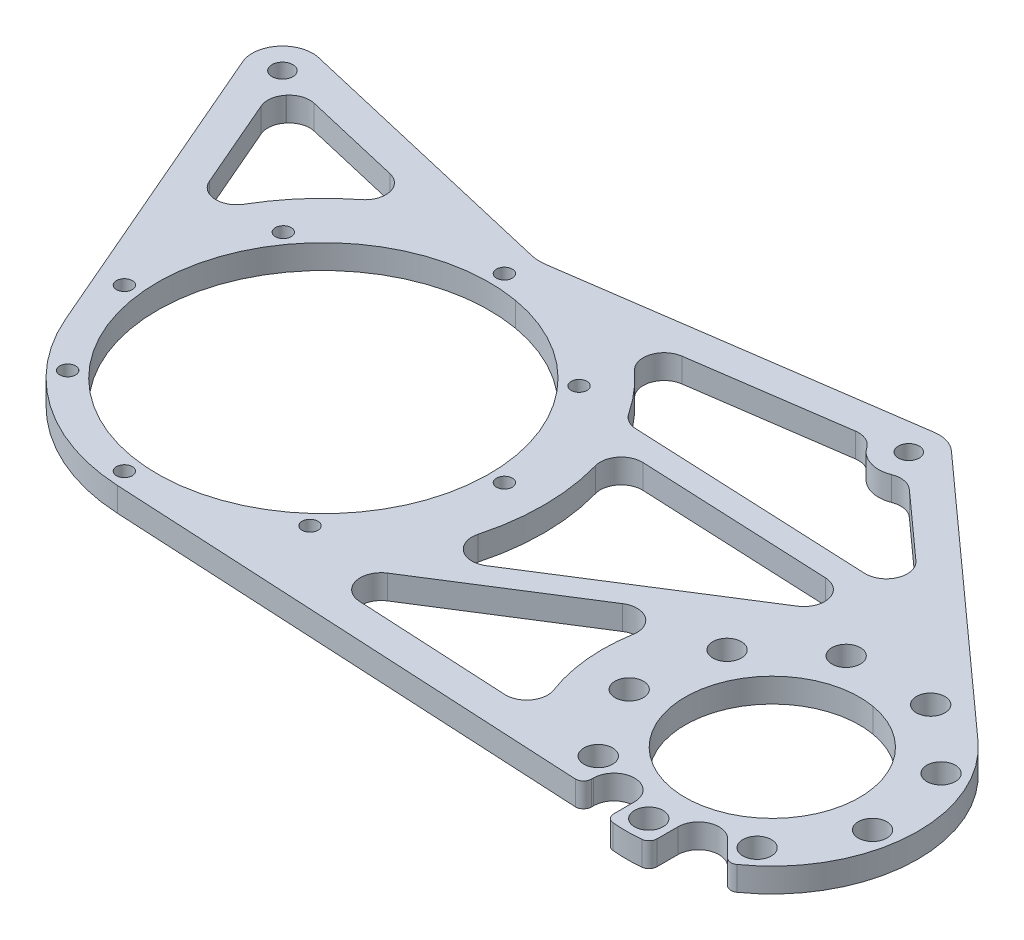
from build123d import *

# Parameters (mm, degrees)
SKETCH2_R           = 4.5
SKETCH2_R_2         = 27.4955
SKETCH2_R_3         = 2.5
SKETCH2_R_4         = 52.3875
SKETCH2_R_5         = 3.3
BOSS_EXTRUDE1_DEPTH = 7.62
CUT_EXTRUDE1_DEPTH  = 977.654400972
FILLET2_R           = 12.7
CUT_EXTRUDE2_DEPTH  = 977.654400972
FILLET3_R           = 6.604


with BuildPart() as part:
    # Sketch2 → Boss-Extrude1 (new body)
    with BuildSketch(Plane(origin=(0, 31.381947118, 0), x_dir=(1, 0, 0), z_dir=(0, 1, 0))):
        with BuildLine():
            ThreePointArc((-706.758334948, -176.701988839), (-700.258334948, -170.201988839), (-693.758334948, -176.701988839))
            Line((-693.758334948, -176.701988839), (-693.758334948, -183.274721629))
            ThreePointArc((-693.758334948, -183.274721629), (-693.101169654, -184.979577479), (-691.469725918, -185.802250576))
            ThreePointArc((-691.469725918, -185.802250576), (-686.919549358, -186.027976628), (-682.369372798, -185.802250576))
            ThreePointArc((-682.369372798, -185.802250576), (-680.737929062, -184.979577479), (-680.080763768, -183.274721629))
            Line((-680.080763768, -183.274721629), (-680.080763768, -176.701988839))
            ThreePointArc((-680.080763768, -176.701988839), (-676.068206079, -170.696771877), (-668.984569691, -172.105794761))
            Line((-668.984569691, -172.105794761), (-663.719686073, -177.370678379))
            ThreePointArc((-663.719686073, -177.370678379), (-662.142049476, -178.105218992), (-660.461885462, -177.651858179))
            ThreePointArc((-660.461885462, -177.651858179), (-641.02731599, -142.794705094), (-656.175138478, -105.872258186))
            Line((-656.175138478, -105.872258186), (-739.714556945, -30.733548866))
            ThreePointArc((-739.714556945, -30.733548866), (-742.67316861, -28.92213442), (-746.084255332, -28.29039661))
            Line((-746.084255332, -28.29039661), (-949.218629158, -22.875315026))
            ThreePointArc((-949.218629158, -22.875315026), (-957.176615495, -27.166188695), (-957.964688125, -36.172857609))
            Line((-957.964688125, -36.172857609), (-915.540423748, -134.526980787))
            ThreePointArc((-915.540423748, -134.526980787), (-894.053054389, -160.825584136), (-861.92593364, -171.83338557))
            Line((-861.92593364, -171.83338557), (-709.298334948, -179.818999281))
            ThreePointArc((-709.298334948, -179.818999281), (-707.502283723, -179.075050505), (-706.758334948, -177.278999281))
            Line((-706.758334948, -177.278999281), (-706.758334948, -176.701988839))
        make_face()
        with Locations((-686.919549358, -179.053976628)):
            Circle(SKETCH2_R, mode=Mode.SUBTRACT)
        with Locations((-711.988266136, -169.92970991)):
            Circle(SKETCH2_R, mode=Mode.SUBTRACT)
        with Locations((-661.85083258, -169.92970991)):
            Circle(SKETCH2_R, mode=Mode.SUBTRACT)
        with Locations((-725.327051725, -146.826255557)):
            Circle(SKETCH2_R, mode=Mode.SUBTRACT)
        with Locations((-686.919549358, -140.053976628)):
            Circle(SKETCH2_R_2, mode=Mode.SUBTRACT)
        with Locations((-648.51204699, -146.826255557)):
            Circle(SKETCH2_R, mode=Mode.SUBTRACT)
        with Locations((-720.694540106, -120.553976628)):
            Circle(SKETCH2_R, mode=Mode.SUBTRACT)
        with Locations((-653.14455861, -120.553976628)):
            Circle(SKETCH2_R, mode=Mode.SUBTRACT)
        with Locations((-700.258334948, -103.405964417)):
            Circle(SKETCH2_R, mode=Mode.SUBTRACT)
        with Locations((-673.580763768, -103.405964417)):
            Circle(SKETCH2_R, mode=Mode.SUBTRACT)
        with Locations((-816.220313684, -71.764639846)):
            Circle(SKETCH2_R_3, mode=Mode.SUBTRACT)
        with Locations((-858.69104046, -52.855453999)):
            Circle(SKETCH2_R_3, mode=Mode.SUBTRACT)
        with Locations((-901.161767236, -148.246268152)):
            Circle(SKETCH2_R_3, mode=Mode.SUBTRACT)
        with Locations((-864.664842136, -166.842380319)):
            Circle(SKETCH2_R_3, mode=Mode.SUBTRACT)
        with Locations((-820.450226307, -152.476180775)):
            Circle(SKETCH2_R_3, mode=Mode.SUBTRACT)
        with Locations((-915.52796678, -115.979255675)):
            Circle(SKETCH2_R_3, mode=Mode.SUBTRACT)
        with Locations((-858.69104046, -110.005453999)):
            Circle(SKETCH2_R_4, mode=Mode.SUBTRACT)
        with Locations((-801.54104046, -110.005453999)):
            Circle(SKETCH2_R_3, mode=Mode.SUBTRACT)
        with Locations((-904.926361688, -76.41352683)):
            Circle(SKETCH2_R_3, mode=Mode.SUBTRACT)
        with Locations((-949.218629158, -32.400315026)):
            Circle(SKETCH2_R_5, mode=Mode.SUBTRACT)
        with Locations((-746.084255332, -37.81539661)):
            Circle(SKETCH2_R_5, mode=Mode.SUBTRACT)
    extrude(amount=BOSS_EXTRUDE1_DEPTH)

    # Sketch3 → Cut-Extrude1 (cut, through all)
    with BuildSketch(Plane.XZ.offset(-31.381947118)):
        with BuildLine():
            ThreePointArc((-746.084255332, 28.29039661), (-746.764244179, 28.314699785), (-747.440763024, 28.387485289))
            Line((-747.440763024, 28.387485289), (-856.972172798, 44.147094697))
            Line((-856.972172798, 44.147094697), (-947.053929007, 23.124556391))
            ThreePointArc((-947.053929007, 23.124556391), (-947.877357404, 22.970224089), (-948.71116187, 22.888842903))
            Line((-948.71116187, 22.888842903), (-746.084255332, 28.29039661))
        make_face()
    extrude(amount=-CUT_EXTRUDE1_DEPTH, mode=Mode.SUBTRACT)

    # Fillet2
    fillet2_edges = [part.edges().sort_by_distance(p)[0] for p in [
        (-856.972172798, 35.191947118, 44.147094697),
    ]]
    fillet(fillet2_edges, radius=FILLET2_R)

    # Sketch4 → Cut-Extrude2 (cut, through all)
    with BuildSketch(Plane.XZ.offset(-31.381947118)):
        with BuildLine():
            ThreePointArc((-755.400758562, 39.797413906), (-748.851749471, 46.929484671), (-739.442809112, 44.643047532))
            Line((-739.442809112, 44.643047532), (-701.500922116, 78.769505081))
            Line((-701.500922116, 78.769505081), (-798.984695976, 74.369503266))
            ThreePointArc((-798.984695976, 74.369503266), (-809.957302285, 60.409170673), (-824.107973934, 49.683152435))
            Line((-824.107973934, 49.683152435), (-755.400758562, 39.797413906))
        make_face()
        with BuildLine():
            Line((-924.603702119, 87.862970189), (-944.871408741, 40.875413825))
            ThreePointArc((-944.871408741, 40.875413825), (-941.911570095, 38.510348812), (-940.107819617, 35.178583284))
            Line((-940.107819617, 35.178583284), (-888.550368384, 47.2106366))
            ThreePointArc((-888.550368384, 47.2106366), (-910.712397168, 63.869275109), (-924.603702119, 87.862970189))
        make_face()
        with BuildLine():
            ThreePointArc((-733.967803565, 114.387293709), (-740.490453219, 141.627220261), (-732.380486266, 168.437423414))
            Line((-732.380486266, 168.437423414), (-812.781759902, 164.230756215))
            Line((-812.781759902, 164.230756215), (-733.967803565, 114.387293709))
        make_face()
        with BuildLine():
            Line((-703.801263295, 86.293435405), (-799.833041569, 147.025779805))
            ThreePointArc((-799.833041569, 147.025779805), (-789.353275134, 115.205728597), (-794.969548727, 82.178487805))
            Line((-794.969548727, 82.178487805), (-703.801263295, 86.293435405))
        make_face()
    extrude(amount=-CUT_EXTRUDE2_DEPTH, mode=Mode.SUBTRACT)

    # Fillet3
    fillet3_edges = [part.edges().sort_by_distance(p)[0] for p in [
        (-733.967803565, 35.191947118, 114.387293709),
        (-732.380486266, 35.191947118, 168.437423414),
        (-812.781759902, 35.191947118, 164.230756215),
        (-703.801263295, 35.191947118, 86.293435405),
        (-794.969548727, 35.191947118, 82.178487805),
        (-799.833041569, 35.191947118, 147.025779805),
        (-701.500922116, 35.191947118, 78.769505081),
        (-798.984695976, 35.191947118, 74.369503266),
        (-824.107973934, 35.191947118, 49.683152435),
        (-888.550368384, 35.191947118, 47.2106366),
        (-924.603702119, 35.191947118, 87.862970189),
        (-739.442809112, 35.191947118, 44.643047532),
        (-755.400758562, 35.191947118, 39.797413906),
        (-940.107819617, 35.191947118, 35.178583284),
        (-944.871408741, 35.191947118, 40.875413825),
    ]]
    fillet(fillet3_edges, radius=FILLET3_R)


solid = part.part
